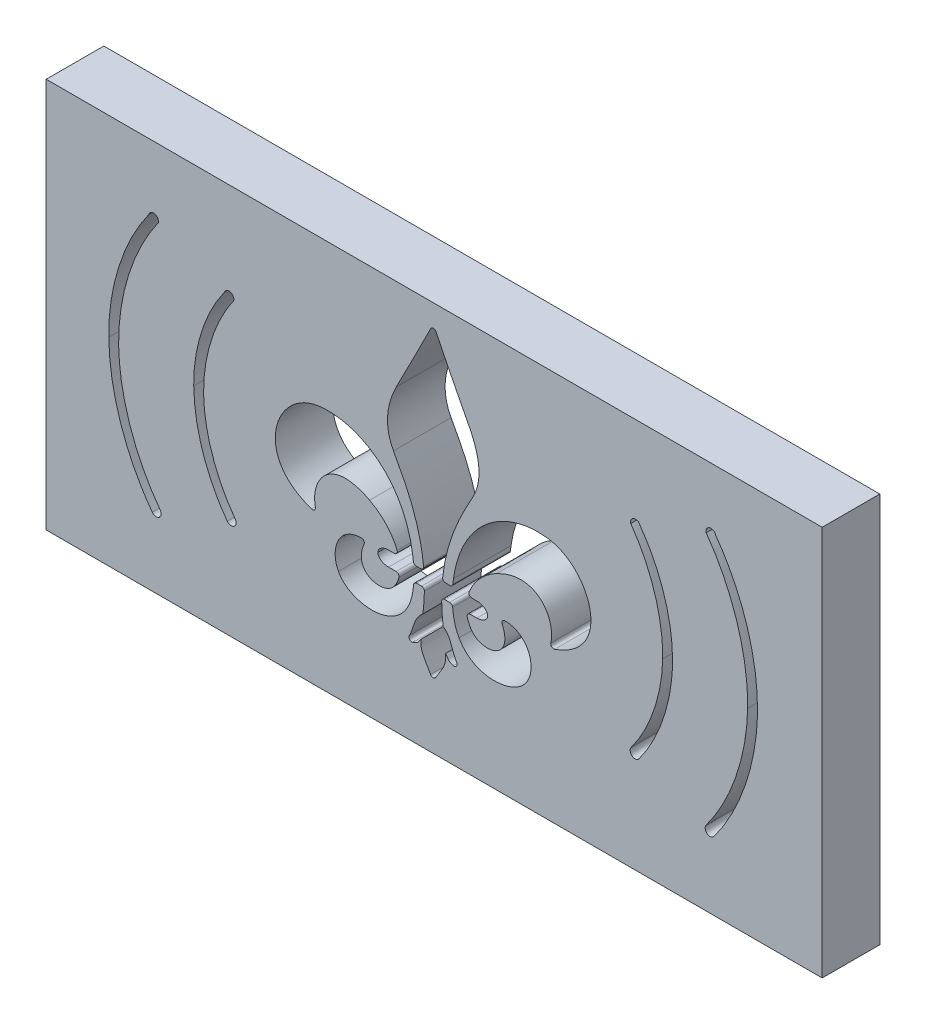
from build123d import *

# Parameters (mm, degrees)
SKETCH3_W           = 134.770113808
SKETCH3_H           = 67.795941397
BOSS_EXTRUDE1_DEPTH = 10
CUT_EXTRUDE1_DEPTH  = 10


with BuildPart() as part:
    # Sketch3 → Boss-Extrude1 (new body)
    with BuildSketch(Plane.XY):
        with Locations((89.466600305, -244.399375782)):
            Rectangle(SKETCH3_W, SKETCH3_H)
    extrude(amount=BOSS_EXTRUDE1_DEPTH)

    # Sketch2 → Cut-Extrude1 (cut)
    with BuildSketch(Plane.XY):
        with BuildLine():
            Line((92.197653811, -251.58493898), (91.440030707, -251.58493898))
            ThreePointArc((91.440030707, -251.58493898), (91.062419819, -251.416753662), (90.93484282, -251.023561096))
            add(Edge.make_bspline(
                [(90.93484282, -251.023561096), (90.950966772, -250.870958095), (90.967996994, -250.718515108), (91.027830263, -250.2277395), (91.074809142, -249.890144179), (91.232804017, -248.880370068), (91.360890163, -248.211205237), (91.662154782, -246.880837216), (91.835718858, -246.218527206), (92.224352895, -244.910128556), (92.439492322, -244.263407736), (93.142944781, -242.344088631), (93.691867693, -241.090490885), (94.595094609, -239.252567764), (94.909348784, -238.646672467), (95.552182293, -237.442214544), (95.881434291, -236.843996236), (96.204438688, -236.242579947)],
                knots=[0.034411252, 0.034411252, 0.034411252, 0.034411252, 0.0625, 0.0625, 0.125, 0.125, 0.25, 0.25, 0.375, 0.375, 0.5, 0.5, 0.75, 0.75, 0.875, 0.875, 1, 1, 1, 1], degree=3))
            add(Edge.make_bspline(
                [(96.204438688, -236.242579947), (96.613306582, -235.481278512), (96.904796639, -234.681298135), (97.157775296, -233.420610452), (97.210811805, -232.98918136), (97.254477104, -232.134927986), (97.246063455, -231.708529765), (97.175005353, -230.857039443), (97.111828475, -230.429679417), (96.938835815, -229.587819662), (96.829665669, -229.174677274), (96.573717508, -228.361309197), (96.426838566, -227.961118173), (96.102383123, -227.171279427), (95.923988894, -226.78191256), (95.737762496, -226.39523571)],
                knots=[0, 0, 0, 0, 0.25, 0.25, 0.375, 0.375, 0.5, 0.5, 0.625, 0.625, 0.75, 0.75, 0.875, 0.875, 1, 1, 1, 1], degree=3))
            add(Edge.make_bspline(
                [(95.737762496, -226.39523571), (95.608426623, -226.126649988), (95.474302929, -225.860520237), (95.205069471, -225.328766552), (95.069378998, -225.063440499), (94.661147322, -224.268057509), (94.387412806, -223.738612696), (93.56598804, -222.150391733), (93.017811205, -221.091865183), (91.928924783, -218.970981668), (91.387673381, -217.908968777), (90.590330293, -216.308795453), (90.326968499, -215.774213534), (89.969575377, -215.03165569), (89.871206648, -214.825814747), (89.773991378, -214.619406041)],
                knots=[0, 0, 0, 0, 0.0625, 0.0625, 0.125, 0.125, 0.25, 0.25, 0.5, 0.5, 0.75, 0.75, 0.875, 0.875, 0.922849796, 0.922849796, 0.922849796, 0.922849796], degree=3))
            ThreePointArc((89.773991378, -214.619406041), (89.314827747, -214.327860132), (88.855189404, -214.618657055))
            add(Edge.make_bspline(
                [(88.855189404, -214.618657055), (88.757339513, -214.825537533), (88.658297252, -215.031828007), (88.298926919, -215.774907376), (88.034145588, -216.309492726), (87.232373177, -217.909573075), (86.687938198, -218.971384845), (85.592656202, -221.091835079), (85.041248158, -222.150104202), (84.215255989, -223.738089365), (83.940042477, -224.267477765), (83.529815869, -225.06288835), (83.393497062, -225.328241995), (83.12318089, -225.86013789), (82.988556489, -226.12635909), (82.859091873, -226.39522216)],
                knots=[0.077055125, 0.077055125, 0.077055125, 0.077055125, 0.125, 0.125, 0.25, 0.25, 0.5, 0.5, 0.75, 0.75, 0.875, 0.875, 0.9375, 0.9375, 1, 1, 1, 1], degree=3))
            add(Edge.make_bspline(
                [(82.859091873, -226.39522216), (82.672824619, -226.7820932), (82.49418424, -227.172008925), (82.168778305, -227.964564955), (82.021212021, -228.366885606), (81.763884273, -229.18661877), (81.654984087, -229.601566666), (81.484444634, -230.435071763), (81.422414724, -230.854732073), (81.351386537, -231.700688007), (81.342359588, -232.126980041), (81.385858681, -232.987265613), (81.438424704, -233.414361346), (81.605179974, -234.249883732), (81.719452998, -234.660265689), (82.010599556, -235.46607773), (82.188166003, -235.86202676), (82.39254843, -236.242581386)],
                knots=[0, 0, 0, 0, 0.125, 0.125, 0.25, 0.25, 0.375, 0.375, 0.5, 0.5, 0.625, 0.625, 0.75, 0.75, 0.875, 0.875, 1, 1, 1, 1], degree=3))
            add(Edge.make_bspline(
                [(82.39254843, -236.242581386), (82.715377948, -236.843734251), (83.044760797, -237.441510839), (83.68788419, -238.645122933), (84.002272723, -239.250624596), (84.905032847, -241.087946494), (85.451886119, -242.340872656), (86.149348747, -244.261096367), (86.362025383, -244.908426896), (86.744809313, -246.218679436), (86.914640553, -246.880993945), (87.2077852, -248.211228725), (87.33148479, -248.880369205), (87.482620204, -249.890133007), (87.527266285, -250.227729212), (87.583814787, -250.719692243), (87.599891136, -250.873324915), (87.615046798, -251.027119526)],
                knots=[0, 0, 0, 0, 0.125, 0.125, 0.25, 0.25, 0.5, 0.5, 0.625, 0.625, 0.75, 0.75, 0.875, 0.875, 0.9375, 0.9375, 0.965807423, 0.965807423, 0.965807423, 0.965807423], degree=3))
            ThreePointArc((87.615046798, -251.027119526), (87.485907789, -251.418080972), (87.109495592, -251.58493898))
            Line((87.109495592, -251.58493898), (86.349764538, -251.58493898))
            ThreePointArc((86.349764538, -251.58493898), (86.009264326, -251.453931826), (85.844386019, -251.128480736))
            add(Edge.make_bspline(
                [(85.844386019, -251.128480736), (85.840922838, -251.094523467), (85.837381553, -251.060574232), (85.833761995, -251.02663359), (85.823849006, -250.933679346), (85.813348545, -250.840785827), (85.802254136, -250.747965177), (85.783468461, -250.590796065), (85.762979369, -250.43382054), (85.740734424, -250.277103618)],
                knots=[0.000458486, 0.000458486, 0.000458486, 0.000458486, 0.000560887, 0.000560887, 0.000560887, 0.000841336, 0.000841336, 0.000841336, 0.001316227, 0.001316227, 0.001316227, 0.001316227], degree=3))
            add(Edge.make_bspline(
                [(85.740734424, -250.277103618), (85.599269459, -249.279422974), (85.393989371, -248.30315913), (84.843200334, -246.397693224), (84.497869913, -245.468431246), (83.858953533, -244.115120125), (83.625573313, -243.670510434), (83.114941686, -242.797457714), (82.841648069, -242.375767425), (81.967048956, -241.155852464), (81.311490181, -240.402399973), (80.209453263, -239.370176646), (79.821021869, -239.042037149), (79.02168839, -238.43531578), (78.608739503, -238.154601965), (77.756331212, -237.638376384), (77.316875358, -237.402858565), (76.410735093, -236.978249277), (75.941791859, -236.788396275), (74.507249785, -236.297897369), (73.531950471, -236.080292947), (71.544039513, -235.86061857), (70.524032201, -235.860584507), (69.516779319, -235.976003805)],
                knots=[0, 0, 0, 0, 0.125, 0.125, 0.25, 0.25, 0.3125, 0.3125, 0.375, 0.375, 0.5, 0.5, 0.5625, 0.5625, 0.625, 0.625, 0.6875, 0.6875, 0.75, 0.75, 0.875, 0.875, 1, 1, 1, 1], degree=3))
            add(Edge.make_bspline(
                [(69.516779319, -235.976003805), (69.014546776, -236.033555864), (68.526018817, -236.137448933), (67.812584713, -236.358745587), (67.578013762, -236.443468361), (67.115326595, -236.634740108), (66.886147152, -236.741870583), (66.217012124, -237.091866259), (65.796857812, -237.361674557), (65.202650959, -237.817054621), (65.010626052, -237.977348753), (64.638651277, -238.314920227), (64.458337556, -238.492705599), (63.94440192, -239.042448126), (63.634484275, -239.433124777), (63.217685642, -240.054686642), (63.086821846, -240.267839898), (62.841781689, -240.706484452), (62.72749337, -240.932469944), (62.416701865, -241.616754201), (62.249575969, -242.085178524), (62.061783026, -242.807020146), (62.009739701, -243.050856761), (61.928220732, -243.545420987), (61.898715291, -243.79767393), (61.848151418, -244.549301509), (61.863711487, -245.046061257), (61.96449614, -245.784402096), (62.011072609, -246.029376069), (62.131733808, -246.516909091), (62.206347535, -246.760379583), (62.466478971, -247.46726861), (62.689195693, -247.913564531), (63.093956089, -248.547213292), (63.241593739, -248.753498331), (63.555537045, -249.148169341), (63.721496431, -249.336421069), (64.244072396, -249.876214522), (64.626869157, -250.204037545), (65.44279797, -250.796992981), (65.869003955, -251.057677752), (66.750260435, -251.522449666), (67.205368391, -251.726424061), (67.837042362, -251.97037819), (68.003157048, -252.031000287), (68.170507379, -252.088787904)],
                knots=[0, 0, 0, 0, 0.0625, 0.0625, 0.09375, 0.09375, 0.125, 0.125, 0.1875, 0.1875, 0.21875, 0.21875, 0.25, 0.25, 0.3125, 0.3125, 0.34375, 0.34375, 0.375, 0.375, 0.4375, 0.4375, 0.46875, 0.46875, 0.5, 0.5, 0.5625, 0.5625, 0.59375, 0.59375, 0.625, 0.625, 0.6875, 0.6875, 0.71875, 0.71875, 0.75, 0.75, 0.8125, 0.8125, 0.875, 0.875, 0.9375, 0.9375, 0.959516948, 0.959516948, 0.959516948, 0.959516948], degree=3))
            ThreePointArc((68.170507379, -252.088787904), (68.673912081, -251.988206626), (68.832567736, -251.499984063))
            add(Edge.make_bspline(
                [(68.832567736, -251.499984063), (68.762108599, -251.178095425), (68.720148728, -250.850192224), (68.673073085, -249.874369591), (68.740327692, -249.240333482), (68.984682486, -248.307729695), (69.089415244, -248.005368576), (69.343548332, -247.424379545), (69.493210495, -247.144658424), (69.842327887, -246.608957081), (70.042168018, -246.35392384), (70.477793632, -245.892797047), (70.715407666, -245.683593243), (71.232944263, -245.310823862), (71.514527912, -245.147462549), (72.09422629, -244.883436592), (72.395363583, -244.780216221), (73.019375278, -244.629220395), (73.338819885, -244.582722287), (73.975861958, -244.542538928), (74.296772928, -244.548368187), (75.257642935, -244.633571828), (75.876250828, -244.776632878), (77.083950439, -245.178630261), (77.673367353, -245.439318634), (78.241001889, -245.737758647)],
                knots=[0.060138867, 0.060138867, 0.060138867, 0.060138867, 0.125, 0.125, 0.25, 0.25, 0.3125, 0.3125, 0.375, 0.375, 0.4375, 0.4375, 0.5, 0.5, 0.5625, 0.5625, 0.625, 0.625, 0.6875, 0.6875, 0.75, 0.75, 0.875, 0.875, 1, 1, 1, 1], degree=3))
            add(Edge.make_bspline(
                [(78.241001889, -245.737758647), (78.828006446, -246.046401397), (79.383048458, -246.403848643), (80.426963963, -247.219777678), (80.906448107, -247.671269009), (81.553177085, -248.408402554), (81.757001869, -248.664505866), (82.139568657, -249.198893713), (82.319182914, -249.478750878), (82.645669342, -250.054789251), (82.792361843, -250.35018654), (82.954997246, -250.732775854), (82.9874797, -250.812594751), (83.018707294, -250.892973048)],
                knots=[0, 0, 0, 0, 0.25, 0.25, 0.5, 0.5, 0.625, 0.625, 0.75, 0.75, 0.875, 0.875, 0.907670984, 0.907670984, 0.907670984, 0.907670984], degree=3))
            ThreePointArc((83.018707294, -250.892973048), (82.964424609, -251.363826856), (82.545187985, -251.58493898))
            Line((82.545187985, -251.58493898), (81.548841842, -251.58493898))
            add(Edge.make_bspline(
                [(81.548841842, -251.58493898), (81.340143448, -251.584938981), (81.135377219, -251.608312547), (80.734344956, -251.705586526), (80.536785334, -251.780550228), (80.17803987, -251.986981589), (80.012519649, -252.120186892), (79.824374762, -252.371081463), (79.772673134, -252.462490189), (79.701033356, -252.658490228), (79.681718996, -252.762676104), (79.681718996, -252.868041288)],
                knots=[0, 0, 0, 0, 0.25, 0.25, 0.5, 0.5, 0.75, 0.75, 0.875, 0.875, 1, 1, 1, 1], degree=3))
            add(Edge.make_bspline(
                [(79.681718996, -252.868041288), (79.681718996, -253.078659902), (79.761050735, -253.280248327), (79.949595193, -253.531912289), (80.021769643, -253.606183529), (80.180152916, -253.740254563), (80.266970304, -253.800093321), (80.535998622, -253.955098304), (80.731765282, -254.029667282), (81.134916144, -254.127765742), (81.340195003, -254.151126973), (81.548841842, -254.151126972)],
                knots=[0, 0, 0, 0, 0.25, 0.25, 0.375, 0.375, 0.5, 0.5, 0.75, 0.75, 1, 1, 1, 1], degree=3))
            Line((81.548841842, -254.151126972), (82.86148027, -254.151126972))
            ThreePointArc((82.86148027, -254.151126972), (83.262140623, -254.346820581), (83.354113297, -254.7831298))
            add(Edge.make_bspline(
                [(83.354113297, -254.7831298), (83.306615727, -254.971826075), (83.248592096, -255.157787294), (83.035534736, -255.722811867), (82.844359572, -256.08676733), (82.61006838, -256.422997215)],
                knots=[0.262431072, 0.262431072, 0.262431072, 0.262431072, 0.5, 0.5, 1, 1, 1, 1], degree=3))
            add(Edge.make_bspline(
                [(82.61006838, -256.422997215), (82.480519877, -256.60884007), (82.331215188, -256.775006969), (81.996675698, -257.071556567), (81.809628684, -257.20240681), (81.418026089, -257.419369403), (81.21122913, -257.507527073), (80.781056992, -257.644205732), (80.562395494, -257.691402723), (80.118461609, -257.74670499), (79.891104015, -257.754497089), (79.444395666, -257.729367169), (79.224072538, -257.696961901), (78.7899162, -257.589670329), (78.574801326, -257.513697584), (78.171866316, -257.319955965), (77.980593844, -257.201088759), (77.629282488, -256.917151129), (77.474625075, -256.756712838), (77.208577719, -256.397779421), (77.097370164, -256.197256491), (76.931694875, -255.781615701), (76.874605986, -255.561257875), (76.810319595, -255.116578787), (76.802488833, -254.893523439), (76.825650694, -254.44626971), (76.857142513, -254.221335466), (76.949105513, -253.784073319), (77.009599312, -253.569806404), (77.143102384, -253.177504127), (77.213269255, -252.998320264), (77.29034942, -252.821636014)],
                knots=[0, 0, 0, 0, 0.0625, 0.0625, 0.125, 0.125, 0.1875, 0.1875, 0.25, 0.25, 0.3125, 0.3125, 0.375, 0.375, 0.4375, 0.4375, 0.5, 0.5, 0.5625, 0.5625, 0.625, 0.625, 0.6875, 0.6875, 0.75, 0.75, 0.8125, 0.8125, 0.875, 0.875, 0.928770523, 0.928770523, 0.928770523, 0.928770523], degree=3))
            ThreePointArc((77.29034942, -252.821636014), (77.245064064, -252.333228013), (76.807900794, -252.110783829))
            add(Edge.make_bspline(
                [(76.807900794, -252.110783829), (76.6455647, -252.116164591), (76.483835358, -252.127727067), (76.107166312, -252.170529489), (75.892758132, -252.207184706), (75.466745054, -252.309055527), (75.253386772, -252.375098793), (74.843290034, -252.535997402), (74.645628467, -252.630800599), (74.265947702, -252.850802951), (74.082460305, -252.977255065), (73.568872399, -253.396495491), (73.277494995, -253.725294158), (72.795275502, -254.470503929), (72.614075919, -254.870553519), (72.356763057, -255.718792487), (72.285038323, -256.153306369), (72.25771292, -256.813480785), (72.262379931, -257.036433295), (72.29945416, -257.474520289), (72.331670088, -257.690855096), (72.424711913, -258.117859341), (72.485496845, -258.32853689), (72.639927809, -258.743384808), (72.733601777, -258.945824427), (72.843386954, -259.139239155)],
                knots=[0.078308556, 0.078308556, 0.078308556, 0.078308556, 0.125, 0.125, 0.1875, 0.1875, 0.25, 0.25, 0.3125, 0.3125, 0.375, 0.375, 0.5, 0.5, 0.625, 0.625, 0.75, 0.75, 0.8125, 0.8125, 0.875, 0.875, 0.9375, 0.9375, 1, 1, 1, 1], degree=3))
            add(Edge.make_bspline(
                [(72.843386954, -259.139239155), (72.975157274, -259.408587414), (73.136781473, -259.655164962), (73.509524524, -260.11056857), (73.722652069, -260.321529324), (74.406698432, -260.890663535), (74.917778738, -261.187787073), (76.010206934, -261.656795124), (76.574165798, -261.820688133), (77.731788886, -262.03026883), (78.329651439, -262.074075344), (79.503708917, -262.035349291), (80.087952874, -261.954173324), (81.237313292, -261.65203349), (81.78391704, -261.436101303), (82.55720341, -261.00450318), (82.808579316, -260.841112522), (83.27976788, -260.485770849), (83.501184312, -260.293214119), (84.123428698, -259.671441286), (84.484663853, -259.19260228), (84.778491575, -258.674132484)],
                knots=[0, 0, 0, 0, 0.0625, 0.0625, 0.125, 0.125, 0.25, 0.25, 0.375, 0.375, 0.5, 0.5, 0.625, 0.625, 0.75, 0.75, 0.8125, 0.8125, 0.875, 0.875, 1, 1, 1, 1], degree=3))
            add(Edge.make_bspline(
                [(84.778491575, -258.674132484), (85.166292752, -257.989581801), (85.425616321, -257.242829605), (85.693975766, -256.095771022), (85.762682711, -255.709307072), (85.84081794, -255.127230707), (85.862705929, -254.932654685), (85.884565751, -254.697340391), (85.8880961, -254.657073409), (85.891465853, -254.616785158)],
                knots=[0, 0, 0, 0, 0.5, 0.5, 0.75, 0.75, 0.875, 0.875, 0.900784636, 0.900784636, 0.900784636, 0.900784636], degree=3))
            ThreePointArc((85.891465853, -254.616785158), (86.053783688, -254.285246215), (86.397698181, -254.151126972))
            Line((86.397698181, -254.151126972), (87.251797917, -254.151126972))
            ThreePointArc((87.251797917, -254.151126972), (87.614234186, -254.303171989), (87.759715226, -254.668292522))
            add(Edge.make_bspline(
                [(87.759715226, -254.668292522), (87.756716174, -254.834487732), (87.752763238, -255.000663512), (87.735734494, -255.505257133), (87.719092022, -255.843489229), (87.653631771, -256.857299658), (87.587423709, -257.531499339), (87.505106466, -258.203757791)],
                knots=[0.127281246, 0.127281246, 0.127281246, 0.127281246, 0.25, 0.25, 0.5, 0.5, 1, 1, 1, 1], degree=3))
            add(Edge.make_bspline(
                [(87.505106466, -258.203757791), (87.40380674, -258.286910502), (87.303184349, -258.370659029), (87.113470507, -258.548299221), (87.023045205, -258.64101757), (86.765503351, -258.931253713), (86.612335109, -259.141041072), (86.206316419, -259.817451895), (86.023611859, -260.30569768), (85.695482197, -261.295415755), (85.547487622, -261.797442286), (85.279856561, -262.39100849), (85.220806462, -262.510500518), (85.156302049, -262.627462845)],
                knots=[0, 0, 0, 0, 0.0625, 0.0625, 0.125, 0.125, 0.25, 0.25, 0.5, 0.5, 0.75, 0.75, 0.814328944, 0.814328944, 0.814328944, 0.814328944], degree=3))
            ThreePointArc((85.156302049, -262.627462845), (85.20207402, -263.187132233), (85.735457065, -263.362709638))
            add(Edge.make_bspline(
                [(85.735457065, -263.362709638), (85.830863791, -263.336552503), (85.925163796, -263.306833661), (86.142759475, -263.226926112), (86.2662584, -263.172497424), (86.439110916, -263.070874227), (86.49440853, -263.033796392), (86.598001003, -262.949970918), (86.647085231, -262.902530667), (86.728614656, -262.794873353), (86.766525827, -262.738981309), (86.845002283, -262.629116404), (86.962716967, -262.464319045), (87.080431651, -262.299521687), (87.158908107, -262.189656781)],
                knots=[0.407311825, 0.407311825, 0.407311825, 0.407311825, 0.5, 0.5, 0.625, 0.625, 0.6875, 0.6875, 0.75, 0.75, 0.8125, 0.8125, 0.875, 1, 1, 1, 1], degree=3))
            add(Edge.make_bspline(
                [(87.158908107, -262.189656781), (87.158908107, -262.427026493), (87.158908107, -262.664396206), (87.158908107, -262.961108346), (87.158363174, -263.020511421), (87.16505704, -263.138451304), (87.171280994, -263.197101056), (87.19705067, -263.372260384), (87.223621619, -263.487988108), (87.322850988, -263.83299925), (87.414895378, -264.060239682), (87.61727832, -264.499389164), (87.728825199, -264.713780569), (88.076243682, -265.350558912), (88.324369626, -265.766674053), (88.655848743, -266.343611114), (88.745345157, -266.501287453), (88.833215531, -266.659866258)],
                knots=[0, 0, 0, 0, 0.125, 0.125, 0.15625, 0.15625, 0.1875, 0.1875, 0.25, 0.25, 0.375, 0.375, 0.5, 0.5, 0.75, 0.75, 0.843642251, 0.843642251, 0.843642251, 0.843642251], degree=3))
            ThreePointArc((88.833215531, -266.659866258), (89.266285983, -266.921524943), (89.710540471, -266.679340647))
            add(Edge.make_bspline(
                [(89.710540471, -266.679340647), (89.806683126, -266.522662397), (89.90469286, -266.367110186), (90.264919494, -265.802183183), (90.533187857, -265.396433362), (91.018359157, -264.554201038), (91.237343241, -264.11598487), (91.383272774, -263.528420032), (91.405991801, -263.408000292), (91.434732371, -263.164893433), (91.438482661, -263.043092656), (91.438482661, -262.677428284), (91.438482661, -262.433652036), (91.438482661, -262.189875788)],
                knots=[0.155438263, 0.155438263, 0.155438263, 0.155438263, 0.25, 0.25, 0.5, 0.5, 0.75, 0.75, 0.8125, 0.8125, 0.875, 0.875, 1, 1, 1, 1], degree=3))
            add(Edge.make_bspline(
                [(91.438482661, -262.189875788), (91.516805009, -262.299487713), (91.634288532, -262.463905599), (91.751772054, -262.628323486), (91.830094403, -262.73793541), (91.868174113, -262.793810875), (91.989342169, -262.954584977), (92.098798803, -263.03579727), (92.331887804, -263.172954226), (92.454700344, -263.226970426), (92.651617519, -263.299187453), (92.723354929, -263.322632995), (92.795786848, -263.34389726)],
                knots=[0, 0, 0, 0, 0.125, 0.1875, 0.1875, 0.25, 0.25, 0.375, 0.375, 0.5, 0.5, 0.570122968, 0.570122968, 0.570122968, 0.570122968], degree=3))
            ThreePointArc((92.795786848, -263.34389726), (93.342922666, -263.164391832), (93.370919948, -262.589243195))
            add(Edge.make_bspline(
                [(93.370919948, -262.589243195), (93.322150566, -262.510395352), (93.275462172, -262.430015609), (93.10795838, -262.123302722), (93.000180359, -261.888071109), (92.80671374, -261.412250051), (92.720291822, -261.170334308), (92.466783904, -260.442350584), (92.308150948, -259.951538567), (92.005617241, -259.390466212), (91.939669152, -259.280986344), (91.793054401, -259.069423574), (91.711427752, -258.966431311), (91.535354332, -258.775861538), (91.440974163, -258.688025507), (91.239604102, -258.527160514), (91.130653598, -258.456433816), (91.02139981, -258.38606325)],
                knots=[0.20450373, 0.20450373, 0.20450373, 0.20450373, 0.25, 0.25, 0.375, 0.375, 0.5, 0.5, 0.75, 0.75, 0.8125, 0.8125, 0.875, 0.875, 0.9375, 0.9375, 1, 1, 1, 1], degree=3))
            add(Edge.make_bspline(
                [(91.02139981, -258.38606325), (90.935456772, -257.683631063), (90.867097977, -256.979045797), (90.801719307, -255.919554795), (90.785539469, -255.56610783), (90.76943477, -255.030316475), (90.765877641, -254.848177291), (90.763405472, -254.666020748)],
                knots=[0, 0, 0, 0, 0.5, 0.5, 0.75, 0.75, 0.878723041, 0.878723041, 0.878723041, 0.878723041], degree=3))
            ThreePointArc((90.763405472, -254.666020748), (90.909719345, -254.302362371), (91.271358694, -254.151126972))
            Line((91.271358694, -254.151126972), (92.150244609, -254.151126972))
            ThreePointArc((92.150244609, -254.151126972), (92.49416129, -254.285248227), (92.656477433, -254.616791081))
            add(Edge.make_bspline(
                [(92.656477433, -254.616791081), (92.659851371, -254.657135057), (92.663386741, -254.69746333), (92.685267719, -254.933017552), (92.707188188, -255.127895789), (92.785536777, -255.711306203), (92.85427251, -256.097446671), (93.122540067, -257.243536169), (93.382066124, -257.990400623), (93.769469071, -258.674099917)],
                knots=[0.099194157, 0.099194157, 0.099194157, 0.099194157, 0.125, 0.125, 0.25, 0.25, 0.5, 0.5, 1, 1, 1, 1], degree=3))
            add(Edge.make_bspline(
                [(93.769469071, -258.674099917), (94.062831453, -259.191768359), (94.41560509, -259.661172322), (95.040436095, -260.287557483), (95.266352332, -260.484262431), (95.737202998, -260.839649572), (95.983258407, -260.999817558), (96.751744747, -261.430333385), (97.310339277, -261.651503996), (98.16398366, -261.876653796), (98.452486303, -261.934826559), (99.037031905, -262.018991358), (99.334282631, -262.044894833), (100.219222459, -262.074298158), (100.805097391, -262.031718197), (101.677784816, -261.874612389), (101.967991308, -261.806141635), (102.533094418, -261.638878413), (102.809631194, -261.539888366), (103.349612547, -261.308477999), (103.613084488, -261.176127554), (104.124428187, -260.87159238), (104.367559681, -260.702123239), (104.821360747, -260.325097495), (105.034238221, -260.115330342), (105.411116969, -259.655621155), (105.57317007, -259.407844066), (105.704571516, -259.139247282)],
                knots=[0, 0, 0, 0, 0.125, 0.125, 0.1875, 0.1875, 0.25, 0.25, 0.375, 0.375, 0.4375, 0.4375, 0.5, 0.5, 0.625, 0.625, 0.6875, 0.6875, 0.75, 0.75, 0.8125, 0.8125, 0.875, 0.875, 0.9375, 0.9375, 1, 1, 1, 1], degree=3))
            add(Edge.make_bspline(
                [(105.704571516, -259.139247282), (105.924033357, -258.752548131), (106.073665035, -258.341810871), (106.21520343, -257.697164615), (106.248145259, -257.47677203), (106.285405042, -257.038704792), (106.29013057, -256.819540128), (106.272540438, -256.380955944), (106.249991935, -256.160278342), (106.177426457, -255.724761238), (106.12781766, -255.511330744), (106.001703415, -255.093205292), (105.925202634, -254.888508818), (105.743109453, -254.488564291), (105.636503041, -254.292141208), (105.280350388, -253.738576922), (104.993171895, -253.410566176), (104.307801428, -252.846117001), (103.927728003, -252.625539337), (103.311769265, -252.380903897), (103.099514189, -252.314308648), (102.673328551, -252.210714435), (102.457810632, -252.173060387), (102.074680713, -252.128504189), (101.907728285, -252.116442557), (101.740103347, -252.110919774)],
                knots=[0, 0, 0, 0, 0.125, 0.125, 0.1875, 0.1875, 0.25, 0.25, 0.3125, 0.3125, 0.375, 0.375, 0.4375, 0.4375, 0.5, 0.5, 0.625, 0.625, 0.75, 0.75, 0.8125, 0.8125, 0.875, 0.875, 0.922526732, 0.922526732, 0.922526732, 0.922526732], degree=3))
            ThreePointArc((101.740103347, -252.110919774), (101.303028642, -252.333385166), (101.257732417, -252.821722549))
            add(Edge.make_bspline(
                [(101.257732417, -252.821722549), (101.333660609, -252.995820029), (101.402881921, -253.172477408), (101.536124169, -253.562571107), (101.597097419, -253.777170677), (101.690192352, -254.217381956), (101.721583652, -254.440409202), (101.745427806, -254.886875364), (101.737764053, -255.113697392), (101.67400962, -255.557874969), (101.618728265, -255.773050988), (101.455165357, -256.187748613), (101.344668821, -256.389018742), (101.080275284, -256.748742174), (100.924390516, -256.911636298), (100.573839618, -257.196636626), (100.383952533, -257.315552209), (99.978383753, -257.511748404), (99.764684647, -257.58757896), (99.329828509, -257.695915815), (99.104773496, -257.729269704), (98.65654132, -257.7545423), (98.433104873, -257.746982504), (97.987579384, -257.691823628), (97.765253293, -257.643620485), (97.340087584, -257.508645412), (97.134920372, -257.421758491), (96.741260394, -257.204364147), (96.554804791, -257.07420497), (96.219696522, -256.778013245), (96.067703525, -256.609145575), (95.937950115, -256.423006046)],
                knots=[0.07164201, 0.07164201, 0.07164201, 0.07164201, 0.125, 0.125, 0.1875, 0.1875, 0.25, 0.25, 0.3125, 0.3125, 0.375, 0.375, 0.4375, 0.4375, 0.5, 0.5, 0.5625, 0.5625, 0.625, 0.625, 0.6875, 0.6875, 0.75, 0.75, 0.8125, 0.8125, 0.875, 0.875, 0.9375, 0.9375, 1, 1, 1, 1], degree=3))
            add(Edge.make_bspline(
                [(95.937950115, -256.423006046), (95.703589484, -256.086836092), (95.51188577, -255.721957542), (95.298993551, -255.157170719), (95.241040497, -254.971340585), (95.193669859, -254.783099224)],
                knots=[0, 0, 0, 0, 0.5, 0.5, 0.73722852, 0.73722852, 0.73722852, 0.73722852], degree=3))
            ThreePointArc((95.193669859, -254.783099224), (95.28565992, -254.346808148), (95.686310581, -254.151126972))
            Line((95.686310581, -254.151126972), (96.882768596, -254.151126972))
            add(Edge.make_bspline(
                [(96.882768596, -254.151126972), (97.091426121, -254.151126973), (97.29642786, -254.127760519), (97.698462346, -254.030092719), (97.895286084, -253.955250519), (98.253836773, -253.74878798), (98.419115134, -253.615852958), (98.607587702, -253.364315599), (98.658949579, -253.273441746), (98.730665864, -253.077070288), (98.749841582, -252.973369524), (98.749841582, -252.868041288)],
                knots=[0, 0, 0, 0, 0.25, 0.25, 0.5, 0.5, 0.75, 0.75, 0.875, 0.875, 1, 1, 1, 1], degree=3))
            add(Edge.make_bspline(
                [(98.749841582, -252.868041288), (98.749841582, -252.657422761), (98.670549511, -252.455828679), (98.482021822, -252.204141546), (98.409850813, -252.129865906), (98.251472008, -251.995790231), (98.164654195, -251.935950223), (97.895622293, -251.780945869), (97.699853491, -251.70638366), (97.296696836, -251.608295655), (97.091416002, -251.584938981), (96.882768596, -251.58493898)],
                knots=[0, 0, 0, 0, 0.25, 0.25, 0.375, 0.375, 0.5, 0.5, 0.75, 0.75, 1, 1, 1, 1], degree=3))
            Line((96.882768596, -251.58493898), (96.002782191, -251.58493898))
            ThreePointArc((96.002782191, -251.58493898), (95.583553987, -251.36383916), (95.529252084, -250.893000844))
            add(Edge.make_bspline(
                [(95.529252084, -250.893000844), (95.560500025, -250.812556185), (95.593012138, -250.732654354), (95.755805338, -250.349676565), (95.902760655, -250.053760406), (96.393912914, -249.187604518), (96.77810129, -248.655362102), (97.426063976, -247.916781442), (97.654246937, -247.680588954), (98.134681909, -247.227942256), (98.387053734, -247.011625397), (99.166620161, -246.402903144), (99.720206603, -246.046269494), (100.306942184, -245.737762498)],
                knots=[0.092319754, 0.092319754, 0.092319754, 0.092319754, 0.125, 0.125, 0.25, 0.25, 0.5, 0.5, 0.625, 0.625, 0.75, 0.75, 1, 1, 1, 1], degree=3))
            add(Edge.make_bspline(
                [(100.306942184, -245.737762498), (100.872495437, -245.440418743), (101.451541279, -245.184130442), (102.347756691, -244.88382163), (102.651140323, -244.797853062), (103.269227634, -244.660360731), (103.585377356, -244.60864799), (104.225605056, -244.549492826), (104.544820966, -244.542382519), (105.181199997, -244.579524472), (105.500880739, -244.624353518), (106.126073129, -244.772107882), (106.427408098, -244.873596088), (106.862026528, -245.068451705), (107.00399459, -245.140525631), (107.281928514, -245.299390078), (107.418627229, -245.386756906), (107.811386561, -245.666043131), (108.051732391, -245.875439905), (108.492274144, -246.337581782), (108.693697995, -246.592771172), (109.045106953, -247.127825524), (109.196756778, -247.408748466), (109.455092312, -247.995634355), (109.561235322, -248.301643351), (109.723879221, -248.918940327), (109.781530187, -249.232592371), (109.849471296, -249.869907558), (109.859228097, -250.193601671), (109.829070803, -250.829793443), (109.789588128, -251.144991364), (109.72074055, -251.471581609), (109.717621623, -251.486094793), (109.714443745, -251.500604149)],
                knots=[0, 0, 0, 0, 0.125, 0.125, 0.1875, 0.1875, 0.25, 0.25, 0.3125, 0.3125, 0.375, 0.375, 0.4375, 0.4375, 0.46875, 0.46875, 0.5, 0.5, 0.5625, 0.5625, 0.625, 0.625, 0.6875, 0.6875, 0.75, 0.75, 0.8125, 0.8125, 0.875, 0.875, 0.9375, 0.9375, 0.940407162, 0.940407162, 0.940407162, 0.940407162], degree=3))
            ThreePointArc((109.714443745, -251.500604149), (109.872977781, -251.98879191), (110.376276377, -252.089543354))
            add(Edge.make_bspline(
                [(110.376276377, -252.089543354), (111.012855291, -251.870044635), (111.631360123, -251.6092474), (112.447540336, -251.179914354), (112.664964819, -251.056504411), (113.092547918, -250.793082323), (113.302934556, -250.652800389), (113.9118039, -250.211143146), (114.291433956, -249.887228211), (114.988768427, -249.169947394), (115.308098115, -248.772410346), (115.846956843, -247.934129336), (116.070489952, -247.490466476), (116.332821503, -246.785985347), (116.408318204, -246.543146531), (116.530971197, -246.055764724), (116.578640295, -245.810329663), (116.647889112, -245.316127724), (116.669467768, -245.067360708), (116.687145446, -244.566572729), (116.68312645, -244.313246421), (116.633764831, -243.559255975), (116.552255356, -243.065830209), (116.301685575, -242.095613699), (116.130927886, -241.616812746), (115.717292667, -240.705833488), (115.473761166, -240.269657482), (115.054614418, -239.643721411), (114.905256608, -239.439170119), (114.592990185, -239.045988259), (114.429732147, -238.856709664), (113.918899678, -238.310486447), (113.550459673, -237.974956533), (112.953734478, -237.516886547), (112.746357187, -237.371155585), (112.323220276, -237.100396742), (112.107172558, -236.975002292), (111.44560721, -236.628739098), (110.986762417, -236.437578669), (110.031228566, -236.139618554), (109.533388108, -236.033576114), (109.030893551, -235.976004265)],
                knots=[0.040651591, 0.040651591, 0.040651591, 0.040651591, 0.125, 0.125, 0.15625, 0.15625, 0.1875, 0.1875, 0.25, 0.25, 0.3125, 0.3125, 0.375, 0.375, 0.40625, 0.40625, 0.4375, 0.4375, 0.46875, 0.46875, 0.5, 0.5, 0.5625, 0.5625, 0.625, 0.625, 0.6875, 0.6875, 0.71875, 0.71875, 0.75, 0.75, 0.8125, 0.8125, 0.84375, 0.84375, 0.875, 0.875, 0.9375, 0.9375, 1, 1, 1, 1], degree=3))
            add(Edge.make_bspline(
                [(109.030893551, -235.976004265), (108.026544778, -235.860917483), (107.028611949, -235.859897876), (105.54087543, -236.021269829), (105.046503987, -236.102452652), (104.060929709, -236.32115207), (103.576722607, -236.457240057), (102.158289921, -236.939815674), (101.253661122, -237.360810645), (99.958363765, -238.141598605), (99.541213465, -238.424601986), (98.744076497, -239.027866977), (98.362557002, -239.34905243), (97.632608579, -240.029373886), (97.284184669, -240.388515642), (96.620232143, -241.144525748), (96.305967126, -241.540364777), (95.428875706, -242.759268866), (94.924910496, -243.620660606), (94.279266722, -244.979383497), (94.08205149, -245.445022767), (93.728288665, -246.384713619), (93.571059491, -246.85988112), (93.15387663, -248.300144174), (92.948209605, -249.279941242), (92.806801777, -250.277140512)],
                knots=[0, 0, 0, 0, 0.125, 0.125, 0.1875, 0.1875, 0.25, 0.25, 0.375, 0.375, 0.4375, 0.4375, 0.5, 0.5, 0.5625, 0.5625, 0.625, 0.625, 0.75, 0.75, 0.8125, 0.8125, 0.875, 0.875, 1, 1, 1, 1], degree=3))
            add(Edge.make_bspline(
                [(92.806801777, -250.277140512), (92.793657156, -250.369745114), (92.781104195, -250.462435656), (92.769148648, -250.555201266), (92.757193097, -250.647966908), (92.74583447, -250.74081148), (92.735080978, -250.833724138), (92.724327481, -250.926636846), (92.714178667, -251.019621595), (92.704645137, -251.112667394), (92.704112829, -251.117862632), (92.703582956, -251.123058113), (92.70305542, -251.128253825)],
                knots=[0, 0, 0, 0, 0.000280599, 0.000280599, 0.000280599, 0.000561197, 0.000561197, 0.000561197, 0.000841796, 0.000841796, 0.000841796, 0.000857464, 0.000857464, 0.000857464, 0.000857464], degree=3))
            ThreePointArc((92.70305542, -251.128253825), (92.538238646, -251.453855378), (92.197653811, -251.58493898))
        make_face()
        with BuildLine():
            ThreePointArc((40.499032816, -266.408263688), (41.693881952, -266.584328398), (41.869946662, -265.389479262))
            add(Edge.make_bspline(
                [(41.869946662, -265.389479262), (40.735120954, -263.86241556), (39.737716449, -262.250982445), (38.426848243, -259.720106016), (38.022373513, -258.859581561), (37.280434631, -257.114709422), (36.94227008, -256.229021156), (36.331236973, -254.431266992), (36.058644681, -253.519223476), (35.584959561, -251.688543899), (35.382967291, -250.767447055), (34.883095075, -247.986628691), (34.689866802, -246.109619352), (34.65654039, -244.206195199)],
                knots=[0, 0, 0, 0, 0.25, 0.25, 0.375, 0.375, 0.5, 0.5, 0.625, 0.625, 0.75, 0.75, 1, 1, 1, 1], degree=3))
            add(Edge.make_bspline(
                [(34.65654039, -244.206195199), (34.632225888, -242.25877908), (34.776981512, -240.324713582), (35.220843203, -237.44151893), (35.40673765, -236.485999849), (35.84969851, -234.596667442), (36.107017746, -233.661161066), (36.692954667, -231.808371062), (37.021931766, -230.890903138), (37.74407304, -229.09512143), (38.138006437, -228.214125145), (39.419914144, -225.622601028), (40.406479046, -223.962758091), (41.544843792, -222.380954642)],
                knots=[0, 0, 0, 0, 0.25, 0.25, 0.375, 0.375, 0.5, 0.5, 0.625, 0.625, 0.75, 0.75, 1, 1, 1, 1], degree=3))
            ThreePointArc((41.544843792, -222.380954642), (40.940738925, -221.335110816), (39.894923577, -221.939264982))
            add(Edge.make_bspline(
                [(39.894923577, -221.939264982), (38.749122583, -223.527004141), (37.746606908, -225.199422406), (36.443621788, -227.826712215), (36.043664971, -228.720277311), (35.315251628, -230.530438265), (34.985954079, -231.448703139), (34.396773445, -233.311449184), (34.137011343, -234.25653014), (33.6932042, -236.151565529), (33.508236925, -237.104157952), (33.065887275, -239.977398921), (32.919316419, -241.913272014), (32.943780204, -243.872643793)],
                knots=[0, 0, 0, 0, 0.25, 0.25, 0.375, 0.375, 0.5, 0.5, 0.625, 0.625, 0.75, 0.75, 1, 1, 1, 1], degree=3))
            add(Edge.make_bspline(
                [(32.943780204, -243.872643793), (32.969015035, -245.893673861), (33.162962062, -247.897526037), (33.682459715, -250.880031099), (33.893890004, -251.868116968), (34.388658027, -253.820660703), (34.672293967, -254.786901295), (35.312087348, -256.699315047), (35.668807862, -257.646225282), (36.447777503, -259.49883595), (36.870808658, -260.407172894), (38.242583876, -263.077184398), (39.29247851, -264.784679777), (40.499032816, -266.408263688)],
                knots=[0, 0, 0, 0, 0.25, 0.25, 0.375, 0.375, 0.5, 0.5, 0.625, 0.625, 0.75, 0.75, 1, 1, 1, 1], degree=3))
        make_face()
        with BuildLine():
            ThreePointArc((53.529021374, -261.241927905), (54.723870668, -261.417991542), (54.899934305, -260.223142249))
            add(Edge.make_bspline(
                [(54.899934305, -260.223142249), (54.038509307, -259.063978467), (53.281080102, -257.840926473), (52.285215089, -255.920170367), (51.977860799, -255.267122386), (51.413888086, -253.942927863), (51.156742872, -253.270773875), (50.69189763, -251.906448429), (50.484414297, -251.214320366), (50.123584787, -249.824997216), (49.969558422, -249.125943301), (49.587807984, -247.015410875), (49.439361357, -245.590736657), (49.411787123, -244.145943263)],
                knots=[0, 0, 0, 0, 0.25, 0.25, 0.375, 0.375, 0.5, 0.5, 0.625, 0.625, 0.75, 0.75, 1, 1, 1, 1], degree=3))
            add(Edge.make_bspline(
                [(49.411787123, -244.145943263), (49.393295169, -242.664978286), (49.503277552, -241.194155669), (49.840587559, -239.001526781), (49.981865028, -238.27484976), (50.31851928, -236.83800274), (50.514088678, -236.126541005), (50.95942113, -234.717466752), (51.209465387, -234.019689782), (51.75835102, -232.653881338), (52.05777518, -231.983813529), (53.032136383, -230.012707532), (53.782013487, -228.750176544), (54.647211232, -227.546901912)],
                knots=[0, 0, 0, 0, 0.25, 0.25, 0.375, 0.375, 0.5, 0.5, 0.625, 0.625, 0.75, 0.75, 1, 1, 1, 1], degree=3))
            ThreePointArc((54.647211232, -227.546901912), (54.043125143, -226.501036875), (52.997297562, -227.105187807))
            add(Edge.make_bspline(
                [(52.997297562, -227.105187807), (52.124457138, -228.314686048), (51.359850568, -229.588148299), (50.366752604, -231.58924138), (50.061873982, -232.269941064), (49.50665846, -233.648814488), (49.255663493, -234.348290994), (48.806580603, -235.767203419), (48.608562017, -236.487174224), (48.270240344, -237.930844687), (48.129235065, -238.656542928), (47.792011995, -240.84540862), (47.680256622, -242.320164515), (47.698894375, -243.812810654)],
                knots=[0, 0, 0, 0, 0.25, 0.25, 0.375, 0.375, 0.5, 0.5, 0.625, 0.625, 0.75, 0.75, 1, 1, 1, 1], degree=3))
            add(Edge.make_bspline(
                [(47.698894375, -243.812810654), (47.718403683, -245.37540185), (47.867600556, -246.924691053), (48.267416994, -249.230570455), (48.43024174, -249.99489063), (48.811323501, -251.504919834), (49.029825854, -252.252128799), (49.522820902, -253.730916641), (49.79792922, -254.463581674), (50.39907861, -255.897239024), (50.725640234, -256.600097308), (51.784951147, -258.665865754), (52.596138211, -259.986608316), (53.529021374, -261.241927905)],
                knots=[0, 0, 0, 0, 0.25, 0.25, 0.375, 0.375, 0.5, 0.5, 0.625, 0.625, 0.75, 0.75, 1, 1, 1, 1], degree=3))
        make_face()
        with BuildLine():
            ThreePointArc((123.659183071, -260.22314174), (123.835245822, -261.417991164), (125.030095246, -261.241928414))
            add(Edge.make_bspline(
                [(125.030095246, -261.241928414), (125.962342929, -259.987465894), (126.777335033, -258.661723355), (127.844063071, -256.578422505), (128.172554634, -255.869435286), (128.77327064, -254.432644461), (129.046191763, -253.70350084), (129.537886669, -252.224001751), (129.756689133, -251.472835239), (130.135477659, -249.965441638), (130.296185408, -249.207278725), (130.691546871, -246.91928232), (130.840704124, -245.376138157), (130.86022262, -243.812810948)],
                knots=[0, 0, 0, 0, 0.25, 0.25, 0.375, 0.375, 0.5, 0.5, 0.625, 0.625, 0.75, 0.75, 1, 1, 1, 1], degree=3))
            add(Edge.make_bspline(
                [(130.86022262, -243.812810948), (130.879943159, -242.233447544), (130.761794743, -240.665317454), (130.400274815, -238.328138533), (130.248780991, -237.552940235), (129.888001126, -236.020953676), (129.678480825, -235.262553751), (129.201529222, -233.760849443), (128.933629983, -233.016882457), (128.345551356, -231.56090386), (128.024785061, -230.84678312), (126.981037409, -228.74668444), (126.175595689, -227.40349496), (125.250923812, -226.122173683)],
                knots=[0, 0, 0, 0, 0.25, 0.25, 0.375, 0.375, 0.5, 0.5, 0.625, 0.625, 0.75, 0.75, 1, 1, 1, 1], degree=3))
            ThreePointArc((125.250923812, -226.122173683), (124.205099094, -225.518021984), (123.601008609, -226.563882062))
            add(Edge.make_bspline(
                [(123.601008609, -226.563882062), (124.517073765, -227.837642628), (125.31562688, -229.180621006), (126.355739797, -231.287988064), (126.674879538, -232.004317665), (127.256201799, -233.455545259), (127.519000745, -234.191677741), (127.989151394, -235.684875453), (128.196357657, -236.442250348), (128.550317481, -237.960848989), (128.697803932, -238.724195841), (129.050399084, -241.026568903), (129.166905866, -242.577754388), (129.147303428, -244.147618807)],
                knots=[0, 0, 0, 0, 0.25, 0.25, 0.375, 0.375, 0.5, 0.5, 0.625, 0.625, 0.75, 0.75, 1, 1, 1, 1], degree=3))
            add(Edge.make_bspline(
                [(129.147303428, -244.147618807), (129.119747899, -245.591410115), (128.971077115, -247.022173577), (128.584576495, -249.150732376), (128.428485395, -249.855340916), (128.065125959, -251.247869833), (127.857658768, -251.936907938), (127.391369375, -253.300593074), (127.132400474, -253.97507775), (126.568512395, -255.294941815), (126.262994956, -255.942208512), (125.274650652, -257.845436747), (124.521056557, -259.063377007), (123.659183071, -260.22314174)],
                knots=[0, 0, 0, 0, 0.25, 0.25, 0.375, 0.375, 0.5, 0.5, 0.625, 0.625, 0.75, 0.75, 1, 1, 1, 1], degree=3))
        make_face()
        with BuildLine():
            ThreePointArc((136.689170337, -265.389479262), (136.865235047, -266.584328398), (138.060084182, -266.408263688))
            add(Edge.make_bspline(
                [(138.060084182, -266.408263688), (139.265740936, -264.785887557), (140.320712706, -263.071744555), (141.702443919, -260.378288029), (142.128053709, -259.461813964), (142.906720273, -257.604347321), (143.260649798, -256.661676692), (143.898507185, -254.748778055), (144.182431726, -253.777629679), (144.674081672, -251.828772831), (144.882751808, -250.848521147), (145.396209881, -247.890125818), (145.590090413, -245.894599706), (145.615336797, -243.872643642)],
                knots=[0, 0, 0, 0, 0.25, 0.25, 0.375, 0.375, 0.5, 0.5, 0.625, 0.625, 0.75, 0.75, 1, 1, 1, 1], degree=3))
            add(Edge.make_bspline(
                [(145.615336797, -243.872643642), (145.640880345, -241.826789954), (145.48795226, -239.795252856), (145.019779169, -236.76710168), (144.823679078, -235.763209977), (144.356572323, -233.778755978), (144.085280595, -232.796269202), (143.467635015, -230.850669093), (143.120818323, -229.887120678), (142.359566692, -228.001435677), (141.944331627, -227.076489611), (140.593138884, -224.356198996), (139.551045121, -222.615737389), (138.353165425, -220.955832649)],
                knots=[0, 0, 0, 0, 0.25, 0.25, 0.375, 0.375, 0.5, 0.5, 0.625, 0.625, 0.75, 0.75, 1, 1, 1, 1], degree=3))
            ThreePointArc((138.353165425, -220.955832649), (137.307351756, -220.351678033), (136.703244312, -221.397518952))
            add(Edge.make_bspline(
                [(136.703244312, -221.397518952), (137.892294821, -223.049555857), (138.928776893, -224.791528104), (140.278813531, -227.525144115), (140.693042739, -228.454354689), (141.44758739, -230.336907306), (141.788700872, -231.291846971), (142.398972728, -233.228916006), (142.66793345, -234.211417298), (143.127402271, -236.181421301), (143.31886226, -237.171682771), (143.776618255, -240.158493029), (143.927986199, -242.170834623), (143.902557481, -244.207470678)],
                knots=[0, 0, 0, 0, 0.25, 0.25, 0.375, 0.375, 0.5, 0.5, 0.625, 0.625, 0.75, 0.75, 1, 1, 1, 1], degree=3))
            add(Edge.make_bspline(
                [(143.902557481, -244.207470678), (143.869252918, -246.109632089), (143.67582947, -247.994774812), (143.169737006, -250.799535264), (142.965026527, -251.728025739), (142.488014458, -253.562998819), (142.215449961, -254.470969101), (141.602503526, -256.267960825), (141.261915044, -257.156799247), (140.520056792, -258.896051504), (140.117997885, -259.748964303), (138.817011404, -262.256800091), (137.824637679, -263.861552588), (136.689170337, -265.389479262)],
                knots=[0, 0, 0, 0, 0.25, 0.25, 0.375, 0.375, 0.5, 0.5, 0.625, 0.625, 0.75, 0.75, 1, 1, 1, 1], degree=3))
        make_face()
    extrude(amount=CUT_EXTRUDE1_DEPTH, mode=Mode.SUBTRACT)


solid = part.part
